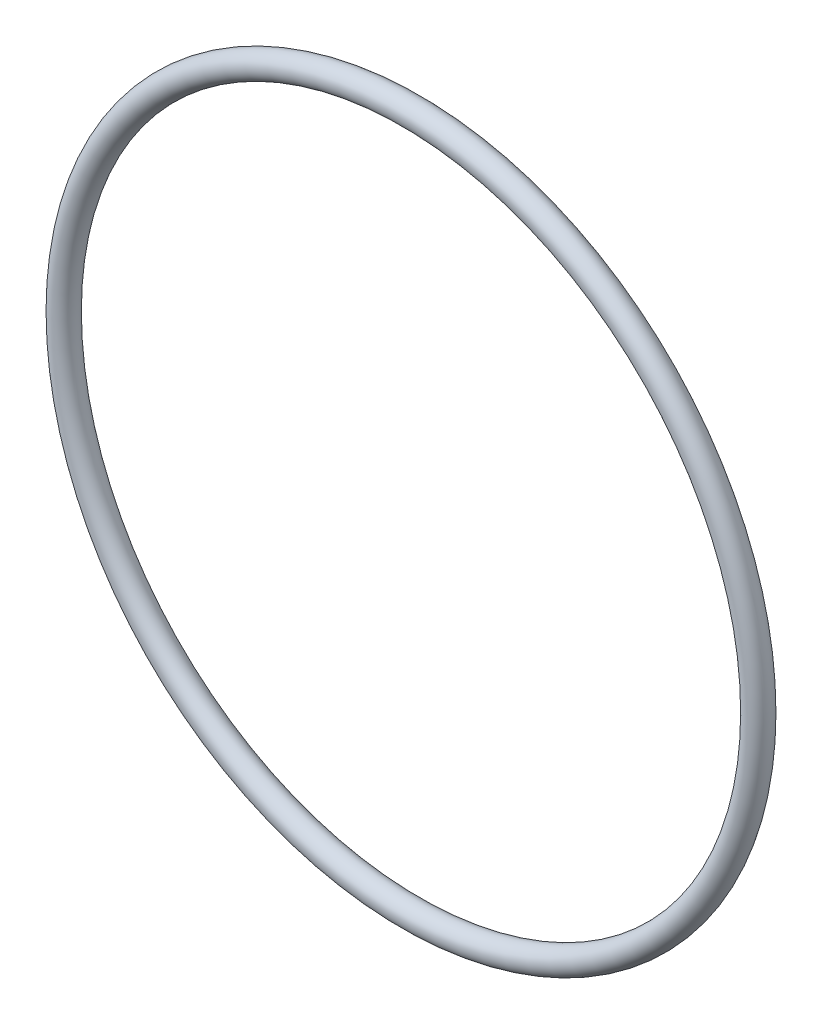
from build123d import *

# Parameters (mm, degrees)
SKETCH1_R = 1.25


with BuildPart() as part:
    # Sketch1 → Revolve1 (revolve)
    with BuildSketch(Plane(origin=(0, 0, 0), x_dir=(0, -1, 0), z_dir=(1, 0, 0))):
        with Locations((34.75, 0)):
            Circle(SKETCH1_R)
    revolve(axis=Axis((0, 0, 1.25), (0, 0, -1)))


solid = part.part
